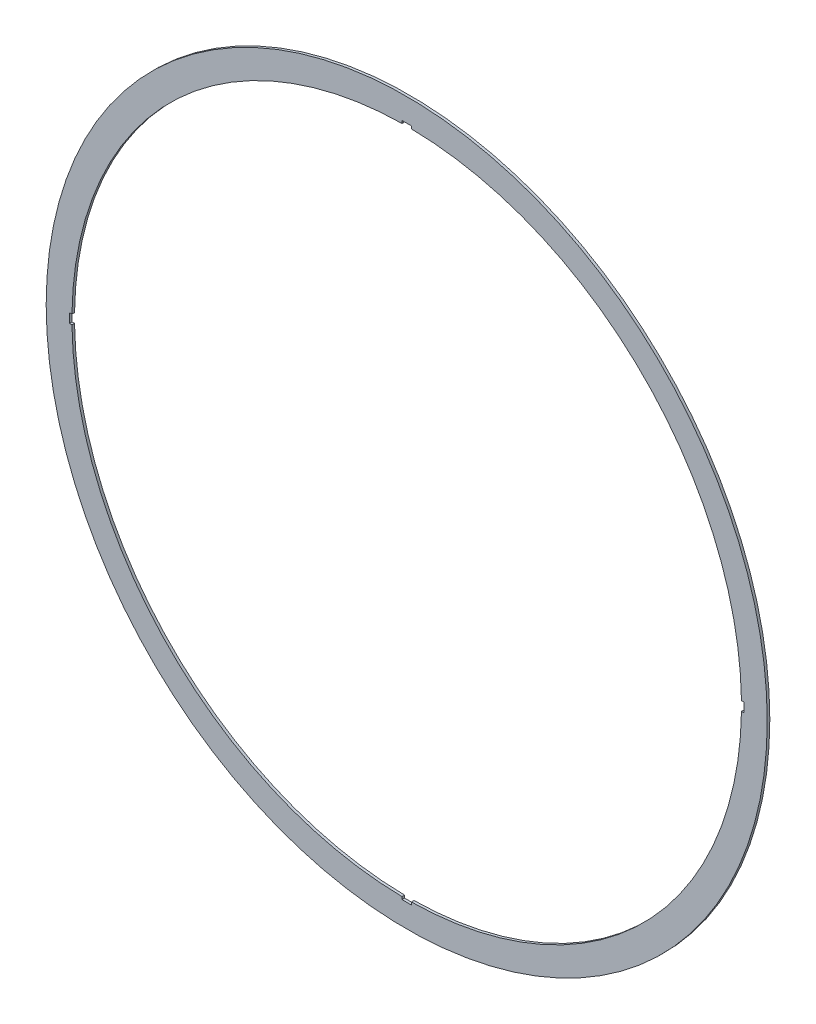
from build123d import *

# Parameters (mm, degrees)
SKETCH1_R           = 420
BOSS_EXTRUDE1_DEPTH = 3


with BuildPart() as part:
    # Sketch1 → Boss-Extrude1 (new body)
    with BuildSketch(Plane.XY):
        Circle(SKETCH1_R)
        with BuildLine():
            Line((393.003894186, 5.441860465), (389.962031683, 5.441860465))
            ThreePointArc((389.962031683, 5.441860465), (275.771644663, 275.771644663), (5.441860465, 389.962031683))
            Line((5.441860465, 389.962031683), (5.441860465, 393.003894186))
            Line((5.441860465, 393.003894186), (-5.441860465, 393.003894186))
            Line((-5.441860465, 393.003894186), (-5.441860465, 389.962031683))
            ThreePointArc((-5.441860465, 389.962031683), (-275.771644663, 275.771644663), (-389.962031683, 5.441860465))
            Line((-389.962031683, 5.441860465), (-393.003894186, 5.441860465))
            Line((-393.003894186, 5.441860465), (-393.003894186, -5.441860465))
            Line((-393.003894186, -5.441860465), (-389.962031683, -5.441860465))
            ThreePointArc((-389.962031683, -5.441860465), (-275.771644663, -275.771644663), (-5.441860465, -389.962031683))
            Line((-5.441860465, -389.962031683), (-5.441860465, -393.003894186))
            Line((-5.441860465, -393.003894186), (5.441860465, -393.003894186))
            Line((5.441860465, -393.003894186), (5.441860465, -389.962031683))
            ThreePointArc((5.441860465, -389.962031683), (275.771644663, -275.771644663), (389.962031683, -5.441860465))
            Line((389.962031683, -5.441860465), (393.003894186, -5.441860465))
            Line((393.003894186, -5.441860465), (393.003894186, 5.441860465))
        make_face(mode=Mode.SUBTRACT)
    extrude(amount=BOSS_EXTRUDE1_DEPTH)


solid = part.part
